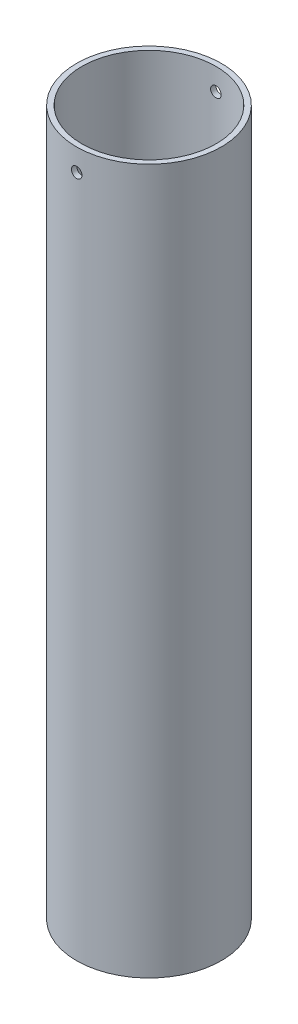
from build123d import *

# Parameters (mm, degrees)
SKETCH2_R               = 41.1
SKETCH2_R_2             = 38.1
BOSS_EXTRUDE1_DEPTH     = 200
CUT_EXTRUDE1_DEPTH      = 209.274866463
CUT_EXTRUDE1_DEPTH_BACK = 209.274866463
SKETCH4_R               = 3


with BuildPart() as part:
    # Sketch2 → Boss-Extrude1 (new, symmetric)
    with BuildSketch(Plane(origin=(0, 0, 0), x_dir=(1, 0, 0), z_dir=(0, 1, 0))):
        with Locations(Location((0, 0, 0), (0, 0, 270))):
            Circle(SKETCH2_R)
        with Locations(Location((0, 0, 0), (0, 0, 270))):
            Circle(SKETCH2_R_2, mode=Mode.SUBTRACT)
    extrude(amount=BOSS_EXTRUDE1_DEPTH, both=True)

    # Sketch4 → Cut-Extrude1 (cut, two sides: drawn at the far end of the back side and taken through both)
    with BuildSketch(Plane.XY.offset(-CUT_EXTRUDE1_DEPTH_BACK)):
        with Locations((0, 187.5)):
            Circle(SKETCH4_R)
    extrude(amount=CUT_EXTRUDE1_DEPTH + CUT_EXTRUDE1_DEPTH_BACK, mode=Mode.SUBTRACT)


solid = part.part
